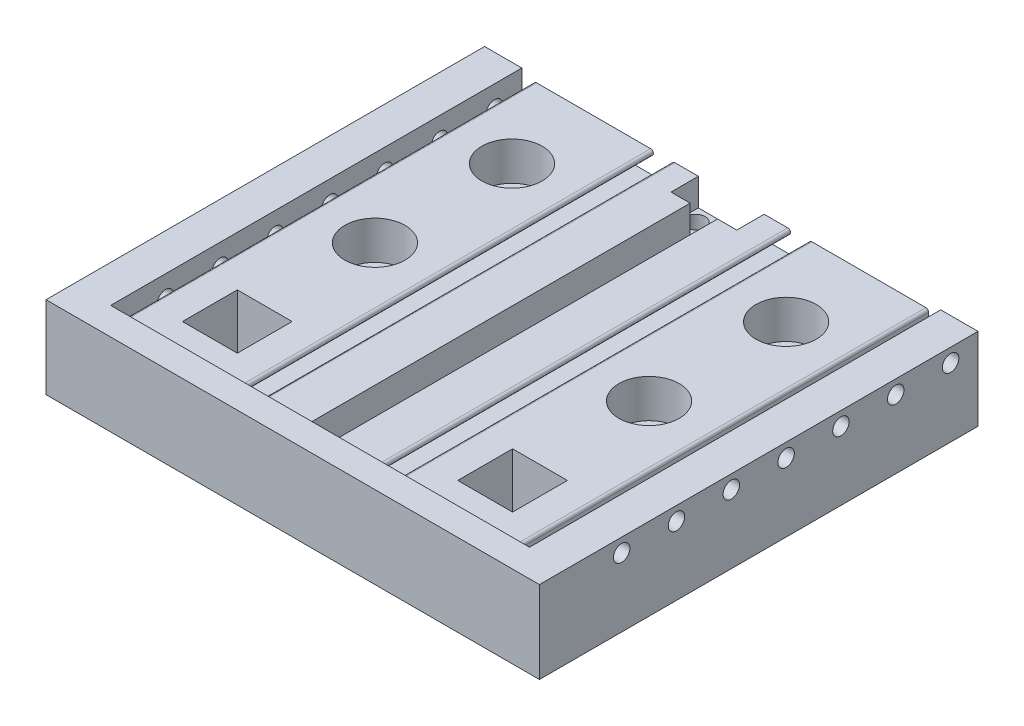
from build123d import *

# Parameters (mm, degrees)
SKETCH1_W           = 90
SKETCH1_H           = 80
BOSS_EXTRUDE1_DEPTH = 14
BOSS_EXTRUDE2_DEPTH = 1
SKETCH3_R           = 3.25
CUT_EXTRUDE1_DEPTH  = 111.613393245
SKETCH4_R           = 5.5
CUT_EXTRUDE2_DEPTH  = 7
SKETCH5_W           = 2
SKETCH5_H           = 6
SKETCH5_W_2         = 5
SKETCH5_H_2         = 5
CUT_EXTRUDE3_DEPTH  = 75
FILLET2_R           = 0.5
SKETCH6_R           = 1.5
CUT_EXTRUDE4_DEPTH  = 7
SKETCH7_R           = 1.5
CUT_EXTRUDE5_DEPTH  = 7
SKETCH8_W           = 12
SKETCH8_H           = 5
CUT_EXTRUDE6_DEPTH  = 5
SKETCH9_R           = 1.75
CUT_EXTRUDE7_DEPTH  = 111.09233745
SKETCH10_R          = 3
SKETCH10_R_2        = 3.25
CUT_EXTRUDE8_DEPTH  = 4
MOVE_FACE1_BY       = 0.2
MOVE_FACE1_2_BY     = 0.2
SKETCH11_W          = 10
SKETCH11_H          = 10
CUT_EXTRUDE10_DEPTH = 111.613393245


with BuildPart() as part:
    # Sketch1 → Boss-Extrude1 (new body)
    with BuildSketch(Plane(origin=(0, 0, 0), x_dir=(1, 0, 0), z_dir=(0, 1, 0))):
        with Locations((32.137715261, -38.032657583)):
            Rectangle(SKETCH1_W, SKETCH1_H)
    extrude(amount=BOSS_EXTRUDE1_DEPTH)

    # Sketch2 → Boss-Extrude2 (add)
    with BuildSketch(Plane(origin=(0, 14, 0), x_dir=(1, 0, 0), z_dir=(0, 1, 0))):
        Polygon((-12.862284739, -78.032657583), (77.137715261, -78.032657583), (77.137715261, -68.032657583), (77.137715261, 1.967342417), (70.137715261, 1.967342417), (70.137715261, -73.032657583), (-5.862284739, -73.032657583), (-5.862284739, 1.967342417), (-12.862284739, 1.967342417), (-12.862284739, -73.032657583), align=None)
    extrude(amount=BOSS_EXTRUDE2_DEPTH)

    # Sketch3 → Cut-Extrude1 (cut, through all)
    with BuildSketch(Plane(origin=(0, 14, 0), x_dir=(1, 0, 0), z_dir=(0, 1, 0))):
        with Locations(Location((57.137715261, -38.032657583, 0), (0, 0, 270))):
            Circle(SKETCH3_R)
        with Locations(Location((7.137715261, -38.032657583, 0), (0, 0, 270))):
            Circle(SKETCH3_R)
        with Locations(Location((7.137715261, -13.032657583, 0), (0, 0, 270))):
            Circle(SKETCH3_R)
        with Locations(Location((57.137715261, -13.032657583, 0), (0, 0, 270))):
            Circle(SKETCH3_R)
    extrude(amount=-CUT_EXTRUDE1_DEPTH, mode=Mode.SUBTRACT)

    # Sketch4 → Cut-Extrude2 (cut)
    with BuildSketch(Plane(origin=(0, 14, 0), x_dir=(1, 0, 0), z_dir=(0, 1, 0))):
        with Locations(Location((7.137715261, -38.032657583, 0), (0, 0, 270))):
            Circle(SKETCH4_R)
        with Locations(Location((57.137715261, -38.032657583, 0), (0, 0, 270))):
            Circle(SKETCH4_R)
        with Locations(Location((57.137715261, -13.032657583, 0), (0, 0, 270))):
            Circle(SKETCH4_R)
        with Locations(Location((7.137715261, -13.032657583, 0), (0, 0, 270))):
            Circle(SKETCH4_R)
    extrude(amount=-CUT_EXTRUDE2_DEPTH, mode=Mode.SUBTRACT)

    # Sketch5 → Cut-Extrude3 (cut)
    with BuildSketch(Plane(origin=(0, 0, -1.967342417), x_dir=(-1, 0, 0), z_dir=(0, 0, -1))):
        Polygon((-45.637715261, 14), (-43.637715261, 14), (-39.637715261, 10), (-49.637715261, 10), align=None)
        Polygon((-14.637715261, 10), (-24.637715261, 10), (-20.637715261, 14), (-18.637715261, 14), align=None)
        with Locations((-69.137715261, 11)):
            Rectangle(SKETCH5_W, SKETCH5_H)
        with Locations((4.862284739, 11)):
            Rectangle(SKETCH5_W, SKETCH5_H)
        with Locations((-32.137715261, 11.5)):
            Rectangle(SKETCH5_W_2, SKETCH5_H_2)
    extrude(amount=-CUT_EXTRUDE3_DEPTH, mode=Mode.SUBTRACT)

    # Fillet2
    fillet2_edges = [part.edges().sort_by_distance(p)[0] for p in [
        (68.137715261, 14, 35.532657583),
        (-3.862284739, 14, 35.532657583),
        (20.637715261, 14, 35.532657583),
        (18.637715261, 14, 35.532657583),
        (43.637715261, 14, 35.532657583),
        (45.637715261, 14, 35.532657583),
    ]]
    fillet(fillet2_edges, radius=FILLET2_R)

    # Sketch6 → Cut-Extrude4 (cut)
    with BuildSketch(Plane(origin=(77.137715261, 0, 0), x_dir=(0, 0, -1), z_dir=(1, 0, 0))):
        with Locations((-3.032657583, 12.5)):
            Circle(SKETCH6_R)
        with Locations((-13.032657583, 12.5)):
            Circle(SKETCH6_R)
        with Locations((-23.032657583, 12.5)):
            Circle(SKETCH6_R)
        with Locations((-33.032657583, 12.5)):
            Circle(SKETCH6_R)
        with Locations((-43.032657583, 12.5)):
            Circle(SKETCH6_R)
        with Locations((-53.032657583, 12.5)):
            Circle(SKETCH6_R)
        with Locations((-63.032657583, 12.5)):
            Circle(SKETCH6_R)
    extrude(amount=-CUT_EXTRUDE4_DEPTH, mode=Mode.SUBTRACT)

    # Sketch7 → Cut-Extrude5 (cut)
    with BuildSketch(Plane.ZY.offset(12.862284739)):
        with Locations((3.032657583, 11)):
            Circle(SKETCH7_R)
        with Locations((13.032657583, 11)):
            Circle(SKETCH7_R)
        with Locations((23.032657583, 11)):
            Circle(SKETCH7_R)
        with Locations((33.032657583, 11)):
            Circle(SKETCH7_R)
        with Locations((43.032657583, 11)):
            Circle(SKETCH7_R)
        with Locations((53.032657583, 11)):
            Circle(SKETCH7_R)
        with Locations((63.032657583, 11)):
            Circle(SKETCH7_R)
    extrude(amount=-CUT_EXTRUDE5_DEPTH, mode=Mode.SUBTRACT)

    # Sketch8 → Cut-Extrude6 (cut)
    with BuildSketch(Plane(origin=(0, 0, -1.967342417), x_dir=(-1, 0, 0), z_dir=(0, 0, -1))):
        with Locations((-32.137715261, 11.5)):
            Rectangle(SKETCH8_W, SKETCH8_H)
    extrude(amount=-CUT_EXTRUDE6_DEPTH, mode=Mode.SUBTRACT)

    # Sketch9 → Cut-Extrude7 (cut, through all)
    with BuildSketch(Plane(origin=(0, 9, 0), x_dir=(1, 0, 0), z_dir=(0, 1, 0))):
        with Locations(Location((36.137715261, -0.532657583, 0), (0, 0, 270))):
            Circle(SKETCH9_R)
        with Locations(Location((28.137715261, -0.532657583, 0), (0, 0, 90))):
            Circle(SKETCH9_R)
    extrude(amount=-CUT_EXTRUDE7_DEPTH, mode=Mode.SUBTRACT)

    # Sketch10 → Cut-Extrude8 (cut)
    with BuildSketch(Plane.XZ):
        with Locations((36.137715261, 0.532657583)):
            Circle(SKETCH10_R)
        with Locations((28.137715261, 0.532657583)):
            Circle(SKETCH10_R_2)
    extrude(amount=-CUT_EXTRUDE8_DEPTH, mode=Mode.SUBTRACT)

    # Move Face1: a face moved inward by 0.2
    extrude(part.faces().sort_by_distance((70.137715261, 11.395945296, 35.792794344))[0], amount=MOVE_FACE1_BY, dir=(1, 0, 0), mode=Mode.SUBTRACT)

    # Move Face1 2: a face moved inward by 0.2
    extrude(part.faces().sort_by_distance((-5.862284739, 11.552027352, 35.792794344))[0], amount=MOVE_FACE1_2_BY, dir=(-1, 0, 0), mode=Mode.SUBTRACT)

    # Sketch11 → Cut-Extrude10 (cut, through all)
    with BuildSketch(Plane(origin=(0, 14, 0), x_dir=(1, 0, 0), z_dir=(0, 1, 0))):
        with Locations((7.03416187, -63.032657583)):
            Rectangle(SKETCH11_W, SKETCH11_H)
        with Locations((57.241268652, -63.032657583)):
            Rectangle(SKETCH11_W, SKETCH11_H)
    extrude(amount=-CUT_EXTRUDE10_DEPTH, mode=Mode.SUBTRACT)


solid = part.part
